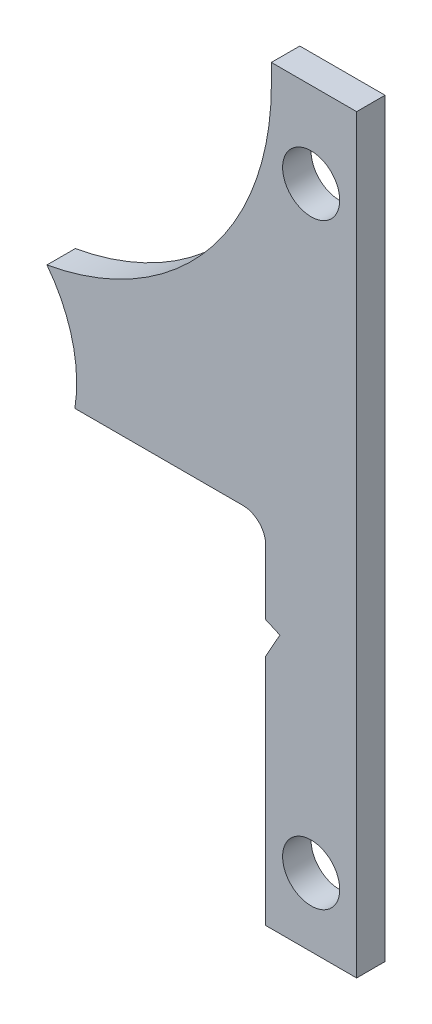
from build123d import *

# Parameters (mm, degrees)
BOSS_EXTRUDE1_DEPTH = 2.5
SKETCH2_R           = 5.025
CUT_EXTRUDE1_DEPTH  = 86.727569626


with BuildPart() as part:
    # Sketch1 → Boss-Extrude1 (new, symmetric)
    with BuildSketch(Plane.XY):
        with BuildLine():
            Line((-49.57019439, -4), (-20, -4))
            ThreePointArc((-20, -4), (-17.171572875, -5.171572875), (-16, -8))
            Line((-16, -8), (-16, -19.403091525))
            Line((-16, -19.403091525), (-13.500700251, -20.50145429))
            Line((-13.500700251, -20.50145429), (-16, -24.97))
            Line((-16, -24.97), (-16, -66))
            Line((-16, -66), (0, -66))
            Line((0, -66), (0, 66))
            Line((0, 66), (-15, 66))
            Line((-15, 66), (-15, 62.56))
            ThreePointArc((-15, 62.56), (-26.17355239, 31.809747222), (-54.481338034, 15.405613876))
            ThreePointArc((-54.481338034, 15.405613876), (-50.022346721, 6.209829337), (-49.57019439, -4))
        make_face()
    extrude(amount=BOSS_EXTRUDE1_DEPTH, both=True)

    # Sketch2 → Cut-Extrude1 (cut, through all)
    with BuildSketch(Plane.XY.offset(2.5)):
        with Locations((-8, 51)):
            Circle(SKETCH2_R)
        with Locations((-8, -54)):
            Circle(SKETCH2_R)
    extrude(amount=-CUT_EXTRUDE1_DEPTH, mode=Mode.SUBTRACT)


solid = part.part
